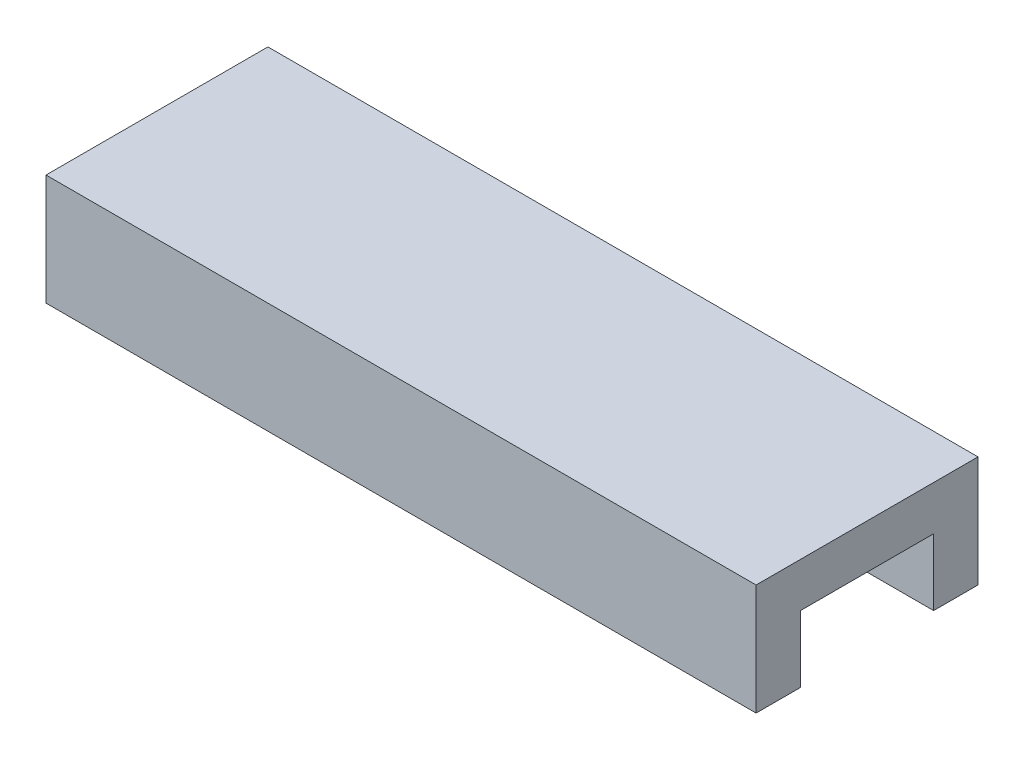
from build123d import *

# Parameters (mm, degrees)
EXTRUDE1_DEPTH = 160


with BuildPart() as part:
    # Sketch1 → Extrude1 (new body)
    with BuildSketch(Plane(origin=(0, 0, 0), x_dir=(0, 0, -1), z_dir=(1, 0, 0))):
        Polygon((-19.92816092, 0), (-19.92816092, 25), (30.07183908, 25), (30.07183908, 0), (20.07183908, 0), (20.07183908, 15), (-9.92816092, 15), (-9.92816092, 0), align=None)
    extrude(amount=EXTRUDE1_DEPTH)


solid = part.part
